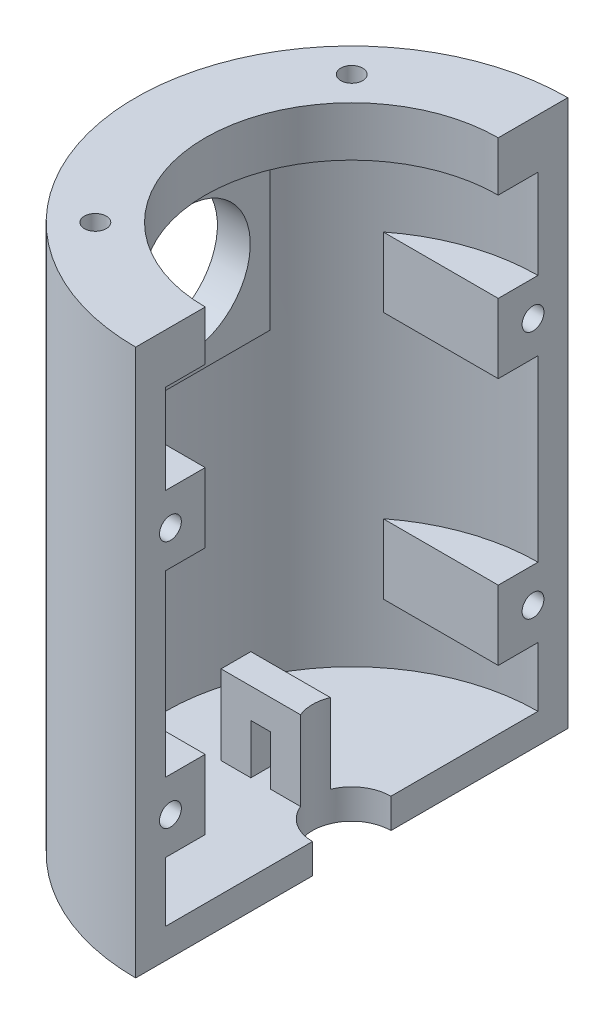
from build123d import *

# Parameters (mm, degrees)
EXTRUDE_1_DEPTH      = 55
CUT_EXTRUDE_START    = -5
SKETCH_2_R           = 18.75
SKETCH_2_R_2         = 14.75
CUT_EXTRUDE_1_DEPTH  = 59.016862823
EXTRUDE_3_REACH      = 65.017
EXTRUDE_3_END_RADIUS = 18.75
SKETCH_4_W           = 7
SKETCH_4_H           = 7
SKETCH_3_R           = 1.1
CUT_EXTRUDE_2_DEPTH  = 5
SKETCH_5_R           = 1.1
CUT_EXTRUDE_3_DEPTH  = 5
CUT_EXTRUDE_START_2  = -22
CUT_EXTRUDE_4_DEPTH  = 17
EXTRUDE_4_DEPTH      = 17
SKETCH_7_R           = 6.5
CUT_EXTRUDE_5_DEPTH  = 63.440972126
EXTRUDE_START        = -3
EXTRUDE_5_DEPTH      = 3
EXTRUDE_START_2      = 8
EXTRUDE_6_DEPTH      = 8
CUT_EXTRUDE_6_REACH  = 65.55
SKETCH_11_W          = 2
SKETCH_11_H          = 5


with BuildPart() as part:
    # ｽｹｯﾁ1 → ﾎﾞｽ - 押し出し1 (new body)
    with BuildSketch(Plane(origin=(0, 0, 0), x_dir=(1, 0, 0), z_dir=(0, 1, 0))):
        with BuildLine():
            Line((0, -21.75), (0, -14.75))
            ThreePointArc((0, -14.75), (-14.75, 0), (0, 14.75))
            Line((0, 14.75), (0, 21.75))
            ThreePointArc((0, 21.75), (-21.75, 0), (0, -21.75))
        make_face()
    extrude(amount=EXTRUDE_1_DEPTH)

    # ｽｹｯﾁ2 → ｶｯﾄ - 押し出し1 (cut, through all)
    with BuildSketch(Plane(origin=(0, 55, 0), x_dir=(1, 0, 0), z_dir=(0, 1, 0)).offset(CUT_EXTRUDE_START)):
        Circle(SKETCH_2_R)
        Circle(SKETCH_2_R_2, mode=Mode.SUBTRACT)
    extrude(amount=-CUT_EXTRUDE_1_DEPTH, mode=Mode.SUBTRACT)

    # ﾎﾞｽ - 押し出し3: up to this cylinder (the profile starts inside it)
    extrude_3_end = Plane(origin=(0, 25, 0), z_dir=(0, 1, 0)) * Cylinder(EXTRUDE_3_END_RADIUS, 193.534, mode=Mode.PRIVATE)
    # ｽｹｯﾁ4 → ﾎﾞｽ - 押し出し3 (add, up to the surface)
    with BuildSketch(Plane(origin=(0, 0, 0), x_dir=(0, 0, -1), z_dir=(1, 0, 0)), mode=Mode.PRIVATE) as extrude_3_sk1:
        with Locations((-18.25, 37.5)):
            Rectangle(SKETCH_4_W, SKETCH_4_H)
    extrude_3_tool1 = extrude(extrude_3_sk1.sketch, amount=-EXTRUDE_3_REACH, mode=Mode.PRIVATE) & extrude_3_end
    add(extrude_3_tool1.solids().sort_by_distance((0, 37.5, 18.25))[0])
    # ｽｹｯﾁ4 → ﾎﾞｽ - 押し出し3 (add, up to the surface)
    with BuildSketch(Plane(origin=(0, 0, 0), x_dir=(0, 0, -1), z_dir=(1, 0, 0)), mode=Mode.PRIVATE) as extrude_3_sk2:
        with Locations((-18.25, 12.5)):
            Rectangle(SKETCH_4_W, SKETCH_4_H)
    extrude_3_tool2 = extrude(extrude_3_sk2.sketch, amount=-EXTRUDE_3_REACH, mode=Mode.PRIVATE) & extrude_3_end
    add(extrude_3_tool2.solids().sort_by_distance((0, 12.5, 18.25))[0])
    # ｽｹｯﾁ4 → ﾎﾞｽ - 押し出し3 (add, up to the surface)
    with BuildSketch(Plane(origin=(0, 0, 0), x_dir=(0, 0, -1), z_dir=(1, 0, 0)), mode=Mode.PRIVATE) as extrude_3_sk3:
        with Locations((18.25, 12.5)):
            Rectangle(SKETCH_4_W, SKETCH_4_H)
    extrude_3_tool3 = extrude(extrude_3_sk3.sketch, amount=-EXTRUDE_3_REACH, mode=Mode.PRIVATE) & extrude_3_end
    add(extrude_3_tool3.solids().sort_by_distance((0, 12.5, -18.25))[0])
    # ｽｹｯﾁ4 → ﾎﾞｽ - 押し出し3 (add, up to the surface)
    with BuildSketch(Plane(origin=(0, 0, 0), x_dir=(0, 0, -1), z_dir=(1, 0, 0)), mode=Mode.PRIVATE) as extrude_3_sk4:
        with Locations((18.25, 37.5)):
            Rectangle(SKETCH_4_W, SKETCH_4_H)
    extrude_3_tool4 = extrude(extrude_3_sk4.sketch, amount=-EXTRUDE_3_REACH, mode=Mode.PRIVATE) & extrude_3_end
    add(extrude_3_tool4.solids().sort_by_distance((0, 37.5, -18.25))[0])

    # ｽｹｯﾁ3 → ｶｯﾄ - 押し出し2 (cut)
    with BuildSketch(Plane(origin=(0, 0, 0), x_dir=(0, 0, -1), z_dir=(1, 0, 0))):
        with Locations((-18.25, 37.5)):
            Circle(SKETCH_3_R)
        with Locations(Location((18.25, 37.5, 0), (0, 0, 180))):
            Circle(SKETCH_3_R)
        with Locations((18.25, 12.5)):
            Circle(SKETCH_3_R)
        with Locations(Location((-18.25, 12.5, 0), (0, 0, 180))):
            Circle(SKETCH_3_R)
    extrude(amount=-CUT_EXTRUDE_2_DEPTH, mode=Mode.SUBTRACT)

    # ｽｹｯﾁ5 → ｶｯﾄ - 押し出し3 (cut)
    with BuildSketch(Plane(origin=(0, 55, 0), x_dir=(1, 0, 0), z_dir=(0, 1, 0))):
        with Locations(Location((-12.904698757, -12.904698757, 0), (0, 0, 270))):
            Circle(SKETCH_5_R)
        with Locations(Location((-12.904698757, 12.904698757, 0), (0, 0, 270))):
            Circle(SKETCH_5_R)
    extrude(amount=-CUT_EXTRUDE_3_DEPTH, mode=Mode.SUBTRACT)

    # ｽｹｯﾁ6 → ｶｯﾄ - 押し出し4 (cut)
    with BuildSketch(Plane(origin=(0, 55, 0), x_dir=(1, 0, 0), z_dir=(0, 1, 0)).offset(CUT_EXTRUDE_START_2)):
        with BuildLine():
            Line((-20.020302196, 8.5), (-20.020302196, -8.5))
            ThreePointArc((-20.020302196, -8.5), (-21.75, 0), (-20.020302196, 8.5))
        make_face()
    extrude(amount=CUT_EXTRUDE_4_DEPTH, mode=Mode.SUBTRACT)

    # ｽｹｯﾁ8 → ﾎﾞｽ - 押し出し4 (add)
    with BuildSketch(Plane.XZ.offset(-50)):
        with BuildLine():
            Line((-16.712644913, 8.5), (-16.712644913, -8.5))
            ThreePointArc((-16.712644913, -8.5), (-18.75, 0), (-16.712644913, 8.5))
        make_face()
    extrude(amount=EXTRUDE_4_DEPTH)

    # ｽｹｯﾁ7 → ｶｯﾄ - 押し出し5 (cut, through all)
    with BuildSketch(Plane.ZY.offset(20.020302196)):
        with Locations((0, 41.5)):
            Circle(SKETCH_7_R)
    extrude(amount=-CUT_EXTRUDE_5_DEPTH, mode=Mode.SUBTRACT)

    # ｽｹｯﾁ9 → ﾎﾞｽ - 押し出し5 (add)
    with BuildSketch(Plane.XZ.offset(EXTRUDE_START)):
        with BuildLine():
            Line((0, 18.75), (0, 3.95))
            ThreePointArc((0, 3.95), (-3.95, 0), (0, -3.95))
            Line((0, -3.95), (0, -18.75))
            ThreePointArc((0, -18.75), (-18.75, 0), (0, 18.75))
        make_face()
    extrude(amount=EXTRUDE_5_DEPTH)

    # ｽｹｯﾁ10 → ﾎﾞｽ - 押し出し6 (add)
    with BuildSketch(Plane(origin=(0, 3, 0), x_dir=(1, 0, 0), z_dir=(0, 1, 0)).offset(EXTRUDE_START_2)):
        with BuildLine():
            Line((-3.654107278, -1.5), (-11.654107278, -1.5))
            Line((-11.654107278, -1.5), (-11.654107278, 1.5))
            Line((-11.654107278, 1.5), (-3.654107278, 1.5))
            ThreePointArc((-3.654107278, 1.5), (-3.95, 0), (-3.654107278, -1.5))
        make_face()
    extrude(amount=-EXTRUDE_6_DEPTH)

    # ｽｹｯﾁ11 → ｶｯﾄ - 押し出し6 (cut, up to next)
    with BuildSketch(Plane.XY.offset(1.5), mode=Mode.PRIVATE) as cut_extrude_6_sk1:
        with Locations((-7.654107278, 5.5)):
            Rectangle(SKETCH_11_W, SKETCH_11_H)
    cut_extrude_6_tool1 = extrude(cut_extrude_6_sk1.sketch, amount=-CUT_EXTRUDE_6_REACH, mode=Mode.PRIVATE) & part.part
    add(cut_extrude_6_tool1.solids().sort_by_distance((-7.654107, 5.5, 1.5))[0], mode=Mode.SUBTRACT)


solid = part.part
